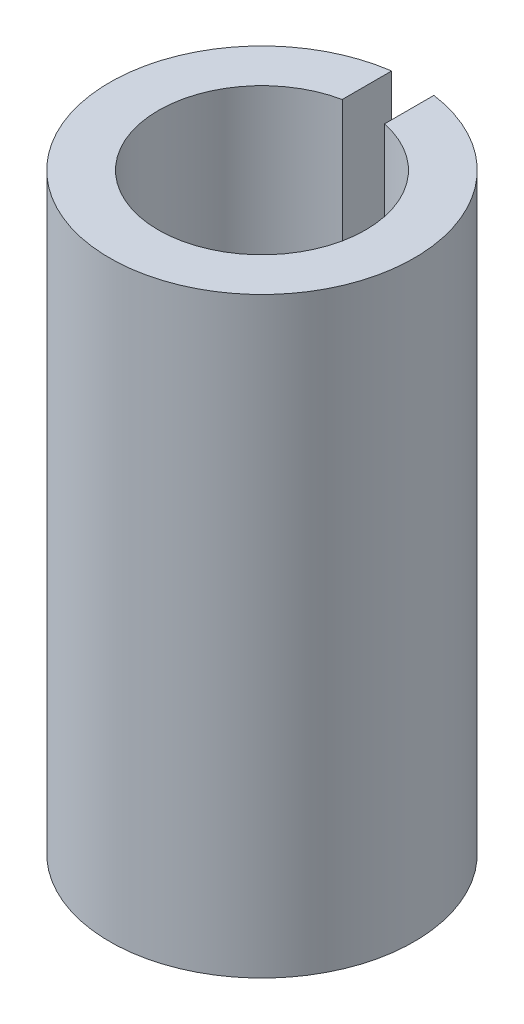
from build123d import *

# Parameters (mm, degrees)
SKETCH_1_R          = 1.8
SKETCH_1_R_2        = 1.225
EXTRUDE_1_DEPTH     = 7
SKETCH_2_W          = 0.5
SKETCH_2_H          = 2.37615298
CUT_EXTRUDE_1_DEPTH = 8.44848978


with BuildPart() as part:
    # 草图1 → 凸台-拉伸1 (new body)
    with BuildSketch(Plane(origin=(0, 0, 0), x_dir=(1, 0, 0), z_dir=(0, 1, 0))):
        with Locations(Location((0, 0, 0), (0, 0, 270))):
            Circle(SKETCH_1_R)
        with Locations(Location((0, 0, 0), (0, 0, 270))):
            Circle(SKETCH_1_R_2, mode=Mode.SUBTRACT)
    extrude(amount=EXTRUDE_1_DEPTH)

    # 草图2 → 切除-拉伸1 (cut, through all)
    with BuildSketch(Plane(origin=(0, 7, 0), x_dir=(1, 0, 0), z_dir=(0, 1, 0))):
        with Locations((0, 1.8)):
            Rectangle(SKETCH_2_W, SKETCH_2_H)
    extrude(amount=-CUT_EXTRUDE_1_DEPTH, mode=Mode.SUBTRACT)


solid = part.part
